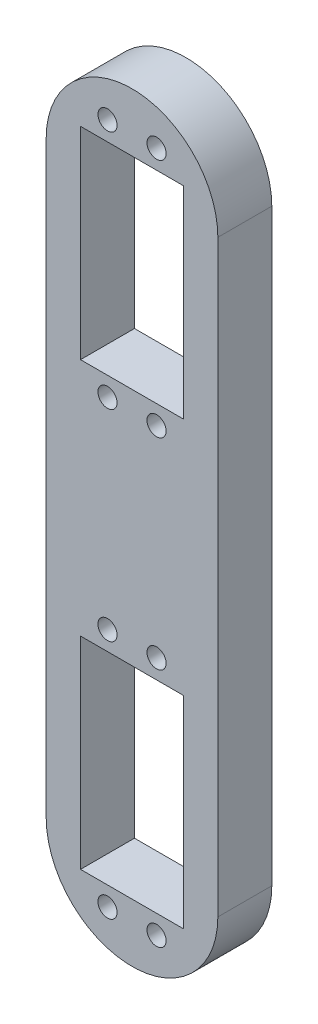
from build123d import *

# Parameters (mm, degrees)
SKETCH1_R           = 1.6
SKETCH1_W           = 21
SKETCH1_H           = 41
BOSS_EXTRUDE1_DEPTH = 11
SKETCH6_W           = 21
SKETCH6_H           = 0.1
CUT_EXTRUDE1_DEPTH  = 91.428148273
SKETCH7_W           = 21
SKETCH7_H           = 41.2
SKETCH7_R           = 1.6
CUT_EXTRUDE2_DEPTH  = 11
SKETCH8_R           = 1.95
CUT_EXTRUDE3_DEPTH  = 11


with BuildPart() as part:
    # Sketch1 → Boss-Extrude1 (new body)
    with BuildSketch(Plane.XY):
        with BuildLine():
            Line((-20, 70), (-20, -50))
            ThreePointArc((-20, -50), (-2.5, -67.5), (15, -50))
            Line((15, -50), (15, 70))
            ThreePointArc((15, 70), (-2.5, 87.5), (-20, 70))
        make_face()
        with Locations((-7.5, 79.5)):
            Circle(SKETCH1_R, mode=Mode.SUBTRACT)
        with Locations(Location((2.5, 79.5, 0), (0, 0, 180))):
            Circle(SKETCH1_R, mode=Mode.SUBTRACT)
        with Locations((2.5, 30.5)):
            Circle(SKETCH1_R, mode=Mode.SUBTRACT)
        with Locations(Location((-7.5, 30.5, 0), (0, 0, 180))):
            Circle(SKETCH1_R, mode=Mode.SUBTRACT)
        with Locations((-2.5, 55)):
            Rectangle(SKETCH1_W, SKETCH1_H, mode=Mode.SUBTRACT)
    extrude(amount=BOSS_EXTRUDE1_DEPTH)

    # Sketch6 → Cut-Extrude1 (cut, through all)
    with BuildSketch(Plane.XY.offset(11)):
        with Locations((-2.5, 75.55)):
            Rectangle(SKETCH6_W, SKETCH6_H)
        with Locations((-2.5, 34.45)):
            Rectangle(SKETCH6_W, SKETCH6_H)
    extrude(amount=-CUT_EXTRUDE1_DEPTH, mode=Mode.SUBTRACT)

    # Sketch7 → Cut-Extrude2 (cut)
    with BuildSketch(Plane(origin=(0, 0, 0), x_dir=(-1, 0, 0), z_dir=(0, 0, -1))):
        with Locations((2.5, -35)):
            Rectangle(SKETCH7_W, SKETCH7_H)
        with Locations((-2.5, -10.5)):
            Circle(SKETCH7_R)
        with Locations((7.5, -10.5)):
            Circle(SKETCH7_R)
        with Locations((-2.5, -59.5)):
            Circle(SKETCH7_R)
        with Locations((7.5, -59.5)):
            Circle(SKETCH7_R)
    extrude(amount=-CUT_EXTRUDE2_DEPTH, mode=Mode.SUBTRACT)

    # Sketch8 → Cut-Extrude3 (cut)
    with BuildSketch(Plane.XY.offset(11)):
        with Locations((-7.5, 79.5)):
            Circle(SKETCH8_R)
        with Locations((2.5, 79.5)):
            Circle(SKETCH8_R)
        with Locations((2.5, 30.5)):
            Circle(SKETCH8_R)
        with Locations((-7.5, 30.5)):
            Circle(SKETCH8_R)
        with Locations((2.5, -10.5)):
            Circle(SKETCH8_R)
        with Locations((-7.5, -10.5)):
            Circle(SKETCH8_R)
        with Locations((2.5, -59.5)):
            Circle(SKETCH8_R)
        with Locations((-7.5, -59.5)):
            Circle(SKETCH8_R)
    extrude(amount=-CUT_EXTRUDE3_DEPTH, mode=Mode.SUBTRACT)


solid = part.part
